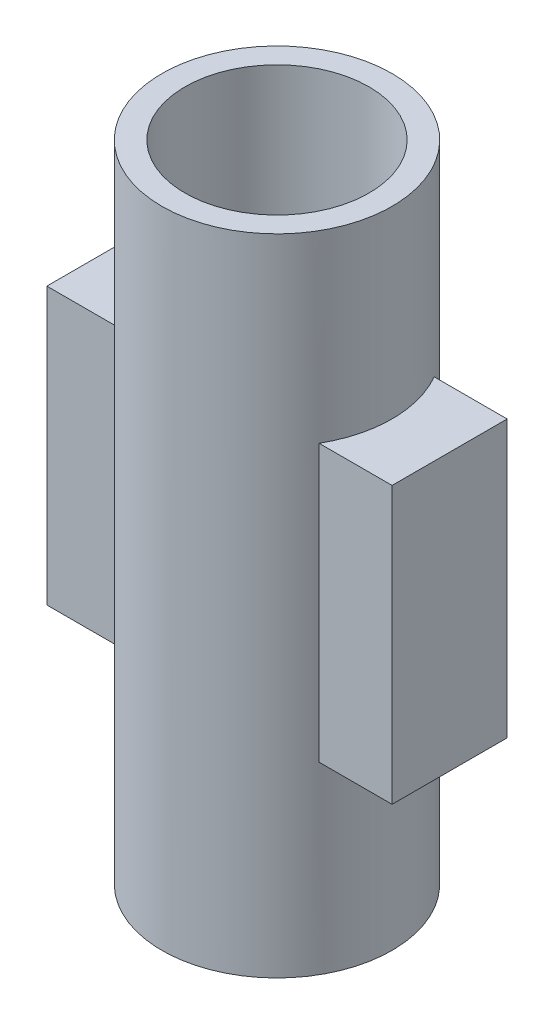
from build123d import *

# Parameters (mm, degrees)
BOSS_EXTRUDE1_DEPTH = 12
SKETCH2_R           = 5
BOSS_EXTRUDE2_DEPTH = 8
BOSS_EXTRUDE3_START = 8
SKETCH3_R           = 5
BOSS_EXTRUDE3_DEPTH = 8
SKETCH4_R           = 4
CUT_EXTRUDE1_DEPTH  = 30.415132160165456


with BuildPart() as part:
    # Sketch1 → Boss-Extrude1 (new body)
    with BuildSketch(Plane(origin=(0, 0, 0), x_dir=(1, 0, 0), z_dir=(0, 1, 0))):
        with BuildLine():
            Line((-4.330127018922256, 2.4999999999999996), (-7.499999999999998, 2.4999999999999996))
            Line((-7.499999999999998, 2.4999999999999996), (-7.499999999999998, -2.5000000000000004))
            Line((-7.499999999999998, -2.5000000000000004), (-4.330127018922255, -2.5000000000000004))
            ThreePointArc((-4.330127018922232, -2.4999999999999334), (-5, 6.1e-16), (-4.330127018922233, 2.4999999999999325))
        make_face()
        with BuildLine():
            ThreePointArc((4.330127018922173, 2.5000000000000346), (-5.965e-14, 5), (-4.330127018922233, 2.4999999999999325))
            Line((-4.330127018922256, 2.4999999999999996), (4.330127018922161, 2.4999999999999996))
        make_face()
        with BuildLine():
            Line((4.330127018922161, 2.4999999999999996), (-4.330127018922256, 2.4999999999999996))
            ThreePointArc((-4.330127018922233, 2.4999999999999325), (-5, 6.1e-16), (-4.330127018922232, -2.4999999999999334))
            Line((-4.330127018922255, -2.5000000000000004), (4.330127018922159, -2.5000000000000004))
            ThreePointArc((4.3301270189221714, -2.5000000000000364), (4.829629131445336, -1.294095225512625), (5, -1.22e-15))
            ThreePointArc((5, 0), (4.829629131445337, 1.2940952255126228), (4.330127018922173, 2.5000000000000346))
        make_face()
        with BuildLine():
            Line((7.500000000000002, 2.4999999999999996), (4.330127018922161, 2.4999999999999996))
            ThreePointArc((4.330127018922173, 2.5000000000000346), (4.829629131445337, 1.2940952255126228), (5, 0))
            ThreePointArc((5, -1.22e-15), (4.829629131445336, -1.294095225512625), (4.3301270189221714, -2.5000000000000364))
            Line((4.330127018922159, -2.5000000000000004), (7.500000000000002, -2.5000000000000004))
            Line((7.500000000000002, -2.5000000000000004), (7.500000000000002, 2.4999999999999996))
        make_face()
        with BuildLine():
            Line((4.330127018922159, -2.5000000000000004), (-4.330127018922255, -2.5000000000000004))
            ThreePointArc((-4.330127018922232, -2.4999999999999334), (-5.865e-14, -5), (4.3301270189221714, -2.5000000000000364))
        make_face()
    extrude(amount=BOSS_EXTRUDE1_DEPTH)

    # Sketch2 → Boss-Extrude2 (add)
    with BuildSketch(Plane(origin=(0, 12, 0), x_dir=(1, 0, 0), z_dir=(0, 1, 0))):
        with Locations(Location((0, 0, 0), (0, 0, 30))):
            Circle(SKETCH2_R)
    extrude(amount=BOSS_EXTRUDE2_DEPTH)

    # Sketch3 → Boss-Extrude3 (add)
    with BuildSketch(Plane.XZ.offset(BOSS_EXTRUDE3_START)):
        with Locations(Location((0, 0, 0), (0, 0, 270))):
            Circle(SKETCH3_R)
    extrude(amount=-BOSS_EXTRUDE3_DEPTH)

    # Sketch4 → Cut-Extrude1 (cut, through all)
    with BuildSketch(Plane.XZ.offset(8)):
        with Locations(Location((0, 0, 0), (0, 0, 270))):
            Circle(SKETCH4_R)
    extrude(amount=-CUT_EXTRUDE1_DEPTH, mode=Mode.SUBTRACT)


solid = part.part
